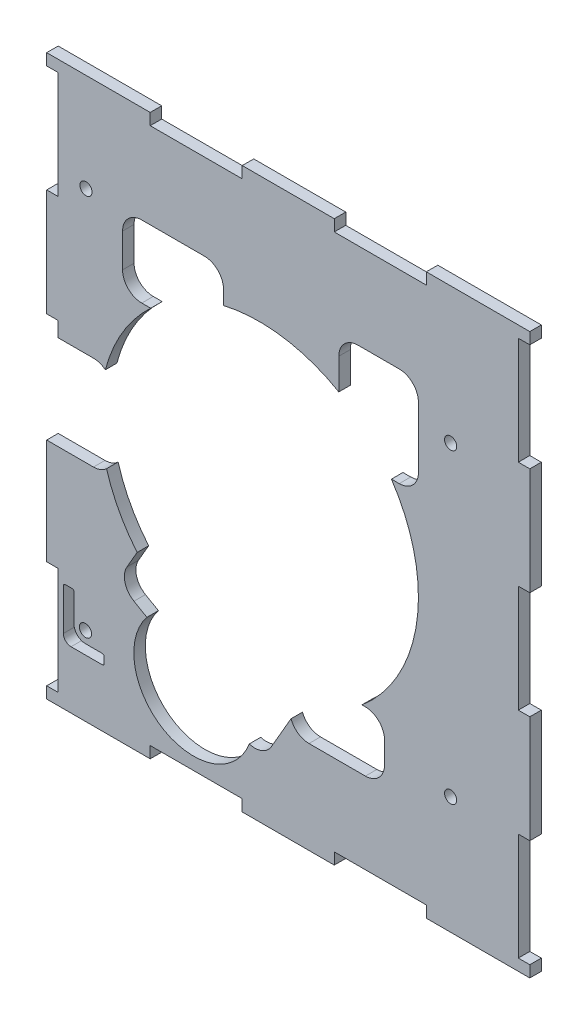
from build123d import *

# Parameters (mm, degrees)
SKETCH1_R           = 1.5875
BOSS_EXTRUDE1_DEPTH = 3


with BuildPart() as part:
    # Sketch1 → Boss-Extrude1 (new body)
    with BuildSketch(Plane.XY):
        with BuildLine():
            Line((48, 140), (24, 140))
            Line((24, 140), (24, 143))
            Line((24, 143), (-3, 143))
            Line((-3, 143), (-3, 140))
            Line((-3, 140), (0, 140))
            Line((0, 140), (0, 112))
            Line((0, 112), (-3, 112))
            Line((-3, 112), (-3, 84))
            Line((-3, 84), (0, 84))
            Line((0, 84), (0, 80.091592476))
            Line((0, 80.091592476), (9.204842615, 80.091592476))
            ThreePointArc((9.204842615, 80.091592476), (10.844002051, 79.815272857), (12.301988723, 79.016855013))
            ThreePointArc((12.301988723, 79.016855013), (16.805573917, 89.764144743), (24.1194552, 98.835729872))
            Line((24.1194552, 98.835729872), (21.793869689, 98.835729872))
            ThreePointArc((21.793869689, 98.835729872), (18.258335784, 100.300195966), (16.793869689, 103.835729872))
            Line((16.793869689, 103.835729872), (16.793869689, 112.604597993))
            ThreePointArc((16.793869689, 112.604597993), (18.258335784, 116.140131899), (21.793869689, 117.604597993))
            Line((21.793869689, 117.604597993), (38.117364989, 117.604597993))
            ThreePointArc((38.117364989, 117.604597993), (41.652898895, 116.140131899), (43.117364989, 112.604597993))
            Line((43.117364989, 112.604597993), (43.117364989, 108.94733597))
            ThreePointArc((43.117364989, 108.94733597), (58.575877607, 109.555709088), (73.183096051, 104.460132622))
            Line((73.183096051, 104.460132622), (73.183096051, 112.523924668))
            ThreePointArc((73.183096051, 112.523924668), (74.647562145, 116.059458574), (78.183096051, 117.523924668))
            Line((78.183096051, 117.523924668), (88.946846839, 117.523924668))
            ThreePointArc((88.946846839, 117.523924668), (92.482380745, 116.059458574), (93.946846839, 112.523924668))
            Line((93.946846839, 112.523924668), (93.946846839, 96.632091269))
            ThreePointArc((93.946846839, 96.632091269), (92.482380745, 93.096557363), (88.946846839, 91.632091269))
            Line((88.946846839, 91.632091269), (86.912064447, 91.632091269))
            ThreePointArc((86.912064447, 91.632091269), (93.547360155, 62.743436939), (79.217418381, 36.796678628))
            Line((79.217418381, 36.796678628), (80.114705661, 36.796678628))
            ThreePointArc((80.114705661, 36.796678628), (83.650239567, 35.332212534), (85.114705661, 31.796678628))
            Line((85.114705661, 31.796678628), (85.114705661, 26.165851447))
            ThreePointArc((85.114705661, 26.165851447), (83.650239567, 22.630317541), (80.114705661, 21.165851447))
            Line((80.114705661, 21.165851447), (65.40791431, 21.165851447))
            ThreePointArc((65.40791431, 21.165851447), (62.555840914, 22.059067139), (60.722774204, 24.419580508))
            Line((60.722774204, 24.419580508), (55.609195041, 15.562601589))
            ThreePointArc((55.609195041, 15.562601589), (53.114505039, 13.411669321), (49.823236264, 13.279239393))
            ThreePointArc((49.823236264, 13.279239393), (27.558248735, 5.305071401), (23.135588282, 28.537744501))
            Line((23.135588282, 28.537744501), (19.764061802, 30.484296222))
            ThreePointArc((19.764061802, 30.484296222), (17.434432671, 33.520328015), (17.933934783, 37.314423241))
            Line((17.933934783, 37.314423241), (20.590822265, 41.91628735))
            ThreePointArc((20.590822265, 41.91628735), (15.836008812, 48.974059185), (12.620809049, 56.853328488))
            ThreePointArc((12.620809049, 56.853328488), (11.041151458, 55.853928303), (9.204842615, 55.50451642))
            Line((9.204842615, 55.50451642), (-3, 55.50451642))
            Line((-3, 55.50451642), (-3, 28))
            Line((-3, 28), (0, 28))
            Line((0, 28), (0, 0))
            Line((0, 0), (-3, 0))
            Line((-3, 0), (-3, -3))
            Line((-3, -3), (24, -3))
            Line((24, -3), (24, 0))
            Line((24, 0), (48, 0))
            Line((48, 0), (48, -3))
            Line((48, -3), (72, -3))
            Line((72, -3), (72, 0))
            Line((72, 0), (96, 0))
            Line((96, 0), (96, -3))
            Line((96, -3), (123, -3))
            Line((123, -3), (123, 0))
            Line((123, 0), (120, 0))
            Line((120, 0), (120, 28))
            Line((120, 28), (123, 28))
            Line((123, 28), (123, 56))
            Line((123, 56), (120, 56))
            Line((120, 56), (120, 84))
            Line((120, 84), (123, 84))
            Line((123, 84), (123, 112))
            Line((123, 112), (120, 112))
            Line((120, 112), (120, 140))
            Line((120, 140), (123, 140))
            Line((123, 140), (123, 143))
            Line((123, 143), (96, 143))
            Line((96, 143), (96, 140))
            Line((96, 140), (72, 140))
            Line((72, 140), (72, 143))
            Line((72, 143), (48, 143))
            Line((48, 143), (48, 140))
        make_face()
        with Locations((7.111536912, 17.559834216)):
            Circle(SKETCH1_R, mode=Mode.SUBTRACT)
        with BuildLine():
            ThreePointArc((11.493043158, 14.559834216), (11.846596549, 14.413387607), (11.993043158, 14.059834216))
            Line((11.993043158, 14.059834216), (11.993043158, 12.498677253))
            ThreePointArc((11.993043158, 12.498677253), (11.846596549, 12.145123862), (11.493043158, 11.998677253))
            Line((11.493043158, 11.998677253), (3.35499228, 11.998677253))
            ThreePointArc((3.35499228, 11.998677253), (1.940778717, 12.58446369), (1.35499228, 13.998677253))
            Line((1.35499228, 13.998677253), (1.35499228, 24.79117874))
            ThreePointArc((1.35499228, 24.79117874), (1.501964385, 25.145256847), (1.856477503, 25.291176534))
            Line((1.856477503, 25.291176534), (3.613022136, 25.285958787))
            ThreePointArc((3.613022136, 25.285958787), (3.965615019, 25.138988887), (4.111536912, 24.785960993))
            Line((4.111536912, 24.785960993), (4.111536912, 17.559834216))
            ThreePointArc((4.111536912, 17.559834216), (4.990216569, 15.438513872), (7.111536912, 14.559834216))
            Line((7.111536912, 14.559834216), (11.493043158, 14.559834216))
        make_face(mode=Mode.SUBTRACT)
        with Locations((102.35, 27.6)):
            Circle(SKETCH1_R, mode=Mode.SUBTRACT)
        with Locations((7.25, 117.4)):
            Circle(SKETCH1_R, mode=Mode.SUBTRACT)
        with Locations((102.35, 107.5)):
            Circle(SKETCH1_R, mode=Mode.SUBTRACT)
    extrude(amount=BOSS_EXTRUDE1_DEPTH)


solid = part.part
